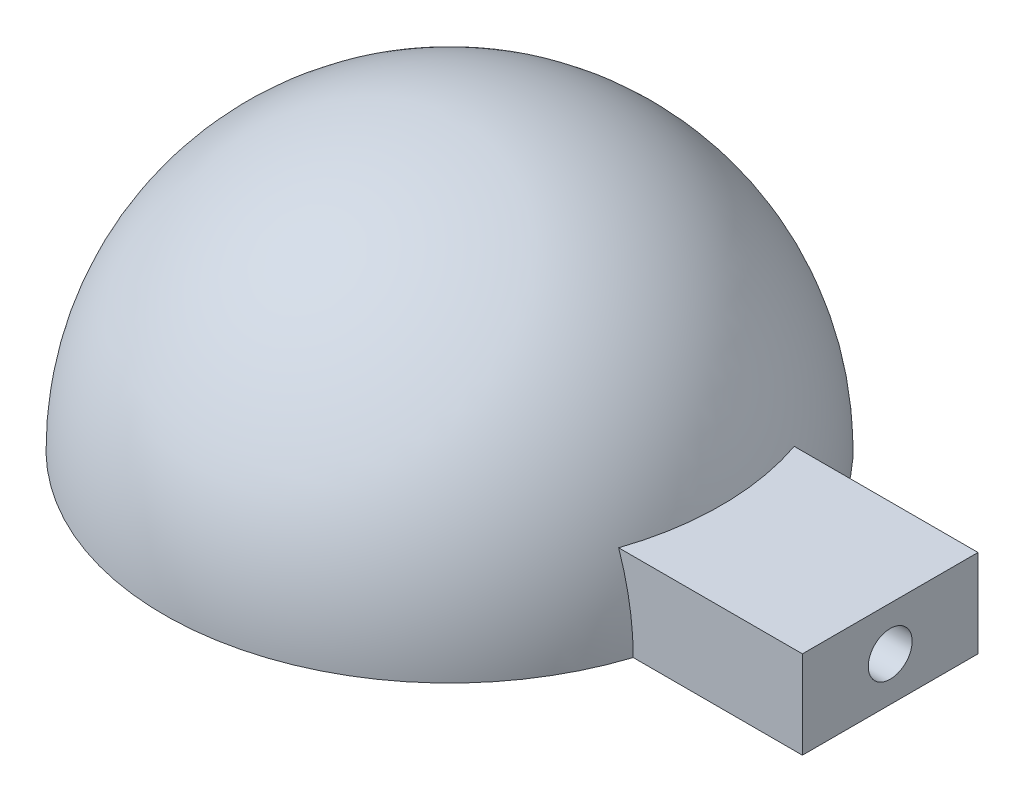
from build123d import *

# Parameters (mm, degrees)
BOSS_EXTRUDE1_DEPTH = 2
SKETCH3_R           = 0.5
CUT_EXTRUDE1_DEPTH  = 2


with BuildPart() as part:
    # Sketch1 → Revolve1 (revolve)
    with BuildSketch(Plane.XY):
        with BuildLine():
            ThreePointArc((-4, 0), (-2.828427125, 2.828427125), (0, 4))
            Line((0, 4), (0, 4.973305283))
            Line((0, 4.973305283), (0, 6.5))
            ThreePointArc((0, 6.5), (-4.596194078, 4.596194078), (-6.5, 0))
            Line((-6.5, 0), (-4, 0))
        make_face()
    revolve(axis=Axis((0, 0, 0), (0, 1, 0)))

    # Sketch2 → Boss-Extrude1 (add)
    with BuildSketch(Plane.XZ):
        with BuildLine():
            Line((10.037634205, 2), (3.464101615, 2))
            ThreePointArc((3.464101615, 2), (4, 0), (3.464101615, -2))
            Line((3.464101615, -2), (10.037634205, -2))
            Line((10.037634205, -2), (10.037634205, 2))
        make_face()
    extrude(amount=-BOSS_EXTRUDE1_DEPTH)

    # Sketch3 → Cut-Extrude1 (cut)
    with BuildSketch(Plane(origin=(10.037634205, 0, 0), x_dir=(0, 0, -1), z_dir=(1, 0, 0))):
        with Locations((0, 1)):
            Circle(SKETCH3_R)
    extrude(amount=-CUT_EXTRUDE1_DEPTH, mode=Mode.SUBTRACT)


solid = part.part
